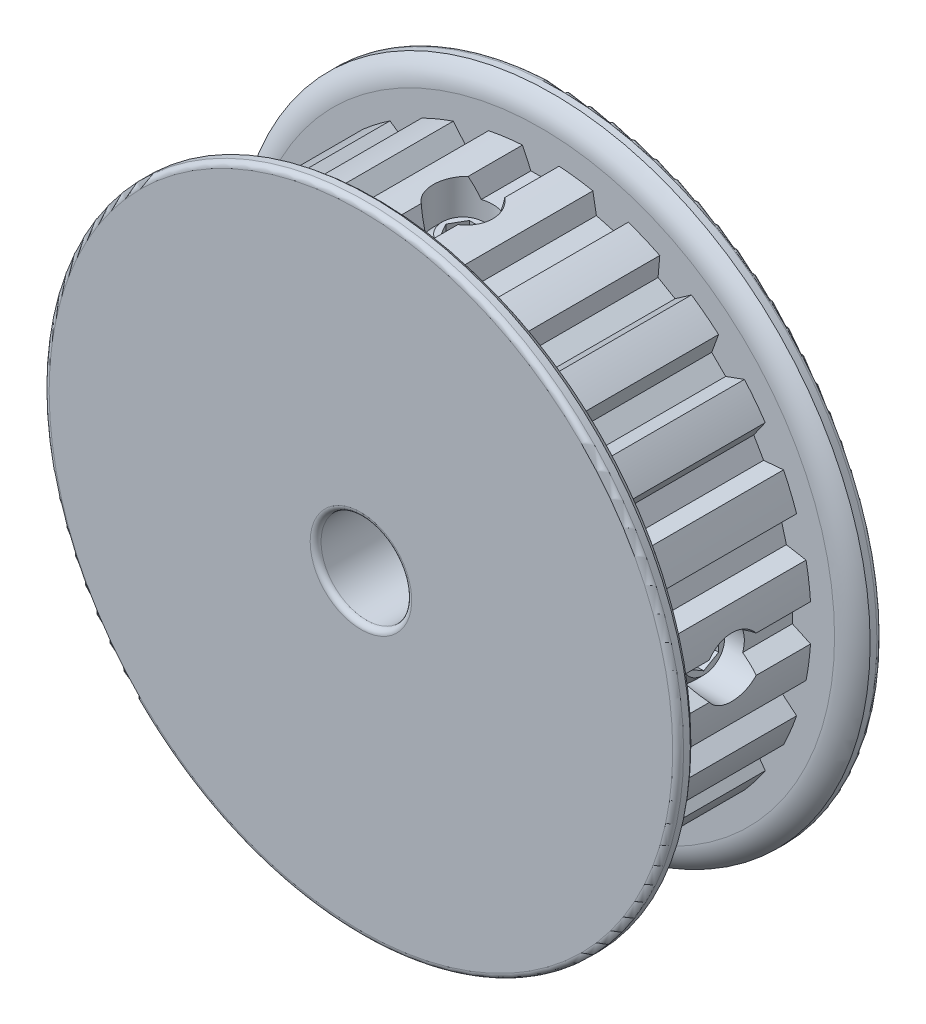
from build123d import *

# Parameters (mm, degrees)
CUT_EXTRUDE1_START = 5.4483
CUT_EXTRUDE1_DEPTH = 10.8966
CIRPATTERN1_COUNT  = 24
FILLET1_R          = 0.381
SKETCH5_R          = 2.0828
CUT_EXTRUDE2_DEPTH = 33.233913576
CUT_EXTRUDE3_DEPTH = 1.0414
CIRPATTERN2_COUNT  = 2
CIRPATTERN2_ANGLE  = 270


with BuildPart() as part:
    # Sketch2 → Revolve1 (revolve)
    with BuildSketch(Plane(origin=(0, 0, 0), x_dir=(0, 0, -1), z_dir=(1, 0, 0)), mode=Mode.PRIVATE) as revolve1_sk:
        with BuildLine():
            Line((-7.1501, 3.175), (7.1501, 3.175))
            Line((7.1501, 3.175), (7.1501, 22.225))
            Line((7.1501, 22.225), (6.2992, 22.225))
            ThreePointArc((6.2992, 22.225), (5.673660763, 21.507711364), (5.4483, 20.583041234))
            Line((5.4483, 20.583041234), (5.4483, 18.941082468))
            Line((5.4483, 18.941082468), (-5.4483, 18.941082468))
            Line((-5.4483, 18.941082468), (-5.4483, 20.583041234))
            ThreePointArc((-5.4483, 20.583041234), (-5.673660763, 21.507711364), (-6.2992, 22.225))
            Line((-6.2992, 22.225), (-7.1501, 22.225))
            Line((-7.1501, 22.225), (-7.1501, 3.175))
        make_face()
    revolve(revolve1_sk.sketch.rotate(Axis((0, 0, 7.1501), (0, 0, -1)), 90), axis=Axis((0, 0, 7.1501), (0, 0, -1)))

    # Sketch3 → Cut-Extrude1 (cut)
    with BuildSketch(Plane.XY.offset(CUT_EXTRUDE1_START)):
        with BuildLine():
            Line((-0.690489274, 17.6276), (0.690489274, 17.6276))
            Line((0.690489274, 17.6276), (1.2827, 18.8976))
            ThreePointArc((1.2827, 18.8976), (0, 18.941082468), (-1.2827, 18.8976))
            Line((-1.2827, 18.8976), (-0.690489274, 17.6276))
        make_face()
    cut_extrude1 = extrude(amount=-CUT_EXTRUDE1_DEPTH, mode=Mode.SUBTRACT)

    # CirPattern1: Cut-Extrude1 ×24 about axis
    cirpattern1_axis = Axis((0, 0, 0), (0, 0, 1))
    for i in range(1, CIRPATTERN1_COUNT):
        add(cut_extrude1.rotate(cirpattern1_axis, i * 360 / CIRPATTERN1_COUNT), mode=Mode.SUBTRACT)

    # Fillet1
    fillet1_edges = [part.edges().sort_by_distance(p)[0] for p in [
        (-22.225, 0, -7.1501),
        (-3.175, 0, -7.1501),
        (-3.175, 0, 7.1501),
        (-22.225, 0, 7.1501),
    ]]
    fillet(fillet1_edges, radius=FILLET1_R)

    # Sketch5 → Cut-Extrude2 (cut, through all)
    with BuildSketch(Plane(origin=(0, 0, 0), x_dir=(1, 0, 0), z_dir=(0, 1, 0))):
        with Locations(Location((0, 0, 0), (0, 0, 90))):
            Circle(SKETCH5_R)
    cut_extrude2 = extrude(amount=CUT_EXTRUDE2_DEPTH, mode=Mode.SUBTRACT)

    # Sketch6 → Revolve2 (revolve)
    with BuildSketch(Plane(origin=(0, 0, 0), x_dir=(0, 0, -1), z_dir=(1, 0, 0)), mode=Mode.PRIVATE) as revolve2_sk:
        Polygon((0, 16.8656), (0, 3.937), (-1.45796, 3.937), (-2.0828, 4.56184), (-2.0828, 16.24076), (-1.45796, 16.8656), align=None)
    revolve2 = revolve(revolve2_sk.sketch.rotate(Axis((0, 16.8656, 0), (0, -1, 0)), 180), axis=Axis((0, 16.8656, 0), (0, -1, 0)))

    # Sketch7 → Cut-Extrude3 (cut)
    with BuildSketch(Plane(origin=(0, 16.8656, 0), x_dir=(1, 0, 0), z_dir=(0, 1, 0))):
        Polygon((1.202505141, 0), (0.60125257, 1.0414), (-0.60125257, 1.0414), (-1.202505141, 0), (-0.60125257, -1.0414), (0.60125257, -1.0414), align=None)
    cut_extrude3 = extrude(amount=-CUT_EXTRUDE3_DEPTH, mode=Mode.SUBTRACT)

    # CirPattern2: Cut-Extrude2, Revolve2, Cut-Extrude3 ×2 about axis
    cirpattern2_axis = Axis((0, 0, 0), (0, 0, 1))
    add([cut_extrude2.rotate(cirpattern2_axis, i * CIRPATTERN2_ANGLE / (CIRPATTERN2_COUNT - 1)) for i in range(1, CIRPATTERN2_COUNT)], mode=Mode.SUBTRACT)
    add([revolve2.rotate(cirpattern2_axis, i * CIRPATTERN2_ANGLE / (CIRPATTERN2_COUNT - 1)) for i in range(1, CIRPATTERN2_COUNT)])
    add([cut_extrude3.rotate(cirpattern2_axis, i * CIRPATTERN2_ANGLE / (CIRPATTERN2_COUNT - 1)) for i in range(1, CIRPATTERN2_COUNT)], mode=Mode.SUBTRACT)


solid = part.part
